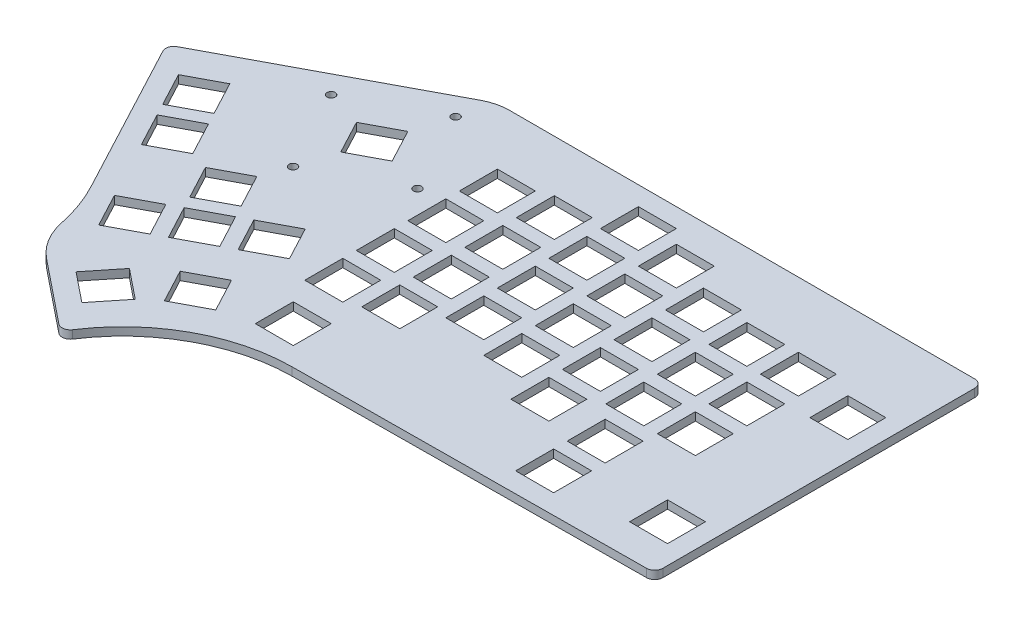
from build123d import *

# Parameters (mm, degrees)
SKETCH3_R   = 1.5
SKETCH3_W   = 14
SKETCH3_H   = 14
LASER_DEPTH = 3


with BuildPart() as part:
    # Sketch3 → Laser (new body)
    with BuildSketch(Plane(origin=(0, 0, 0), x_dir=(1, 0, 0), z_dir=(0, 1, 0))):
        with BuildLine():
            Line((-14.486734177, 37), (157, 37))
            ThreePointArc((157, 37), (159.121320344, 36.121320344), (160, 34))
            Line((160, 34), (160, -80.984375239))
            ThreePointArc((160, -80.984375239), (159.129622744, -83.097360561), (157.023528688, -83.984282971))
            Line((157.023528688, -83.984282971), (27.26862569, -85.001968485))
            ThreePointArc((27.26862569, -85.001968485), (-2.456705292, -92.729196832), (-24.985922812, -113.603576292))
            ThreePointArc((-24.985922812, -113.603576292), (-27.026813158, -114.929395936), (-29.379241112, -114.305606027))
            Line((-29.379241112, -114.305606027), (-52.510135606, -95.72030429))
            ThreePointArc((-52.510135606, -95.72030429), (-58.054538693, -89.41838891), (-61.142600429, -81.61336375))
            ThreePointArc((-61.142600429, -81.61336375), (-63.620659677, -72.842256523), (-67.314962408, -64.51007632))
            Line((-67.314962408, -64.51007632), (-97.34041061, -7.990411949))
            ThreePointArc((-97.34041061, -7.990411949), (-97.559643654, -5.704801569), (-96.098494227, -3.933609797))
            Line((-96.098494227, -3.933609797), (-23.071235452, 34.86131583))
            ThreePointArc((-23.071235452, 34.86131583), (-18.910183965, 36.457280449), (-14.486734177, 37))
        make_face()
        with Locations(Location((-22.393572022, 24.996840478, 0), (0, 0, 270))):
            Circle(SKETCH3_R, mode=Mode.SUBTRACT)
        with Locations(Location((-6.470173498, -4.977237981, 0), (0, 0, 270))):
            Circle(SKETCH3_R, mode=Mode.SUBTRACT)
        with Locations(Location((-36.444251957, -20.900636504, 0), (0, 0, 270))):
            Circle(SKETCH3_R, mode=Mode.SUBTRACT)
        with Locations(Location((-52.367650481, 9.073441955, 0), (0, 0, 270))):
            Circle(SKETCH3_R, mode=Mode.SUBTRACT)
        with Locations((9, -10)):
            Rectangle(SKETCH3_W, SKETCH3_H, mode=Mode.SUBTRACT)
        with Locations((9, 9)):
            Rectangle(SKETCH3_W, SKETCH3_H, mode=Mode.SUBTRACT)
        with Locations((28, 11)):
            Rectangle(SKETCH3_W, SKETCH3_H, mode=Mode.SUBTRACT)
        with Locations((47, 23)):
            Rectangle(SKETCH3_W, SKETCH3_H, mode=Mode.SUBTRACT)
        with Locations((66, 18)):
            Rectangle(SKETCH3_W, SKETCH3_H, mode=Mode.SUBTRACT)
        with Locations((85, 9)):
            Rectangle(SKETCH3_W, SKETCH3_H, mode=Mode.SUBTRACT)
        with Locations((104, 6)):
            Rectangle(SKETCH3_W, SKETCH3_H, mode=Mode.SUBTRACT)
        with Locations((123, 6)):
            Rectangle(SKETCH3_W, SKETCH3_H, mode=Mode.SUBTRACT)
        with Locations((146, 1.25)):
            Rectangle(SKETCH3_W, SKETCH3_H, mode=Mode.SUBTRACT)
        with Locations((146, -65.25)):
            Rectangle(SKETCH3_W, SKETCH3_H, mode=Mode.SUBTRACT)
        with Locations((28, -8)):
            Rectangle(SKETCH3_W, SKETCH3_H, mode=Mode.SUBTRACT)
        with Locations((47, 4)):
            Rectangle(SKETCH3_W, SKETCH3_H, mode=Mode.SUBTRACT)
        with Locations((66, -1)):
            Rectangle(SKETCH3_W, SKETCH3_H, mode=Mode.SUBTRACT)
        with Locations((85, -10)):
            Rectangle(SKETCH3_W, SKETCH3_H, mode=Mode.SUBTRACT)
        with Locations((104, -13)):
            Rectangle(SKETCH3_W, SKETCH3_H, mode=Mode.SUBTRACT)
        with Locations((123, -13)):
            Rectangle(SKETCH3_W, SKETCH3_H, mode=Mode.SUBTRACT)
        with Locations((9, -29)):
            Rectangle(SKETCH3_W, SKETCH3_H, mode=Mode.SUBTRACT)
        with Locations((28, -27)):
            Rectangle(SKETCH3_W, SKETCH3_H, mode=Mode.SUBTRACT)
        with Locations((47, -15)):
            Rectangle(SKETCH3_W, SKETCH3_H, mode=Mode.SUBTRACT)
        with Locations((66, -20)):
            Rectangle(SKETCH3_W, SKETCH3_H, mode=Mode.SUBTRACT)
        with Locations((85, -29)):
            Rectangle(SKETCH3_W, SKETCH3_H, mode=Mode.SUBTRACT)
        with Locations((104, -32)):
            Rectangle(SKETCH3_W, SKETCH3_H, mode=Mode.SUBTRACT)
        with Locations((123, -32)):
            Rectangle(SKETCH3_W, SKETCH3_H, mode=Mode.SUBTRACT)
        with Locations((9, -48)):
            Rectangle(SKETCH3_W, SKETCH3_H, mode=Mode.SUBTRACT)
        with Locations((28, -46)):
            Rectangle(SKETCH3_W, SKETCH3_H, mode=Mode.SUBTRACT)
        with Locations((47, -34)):
            Rectangle(SKETCH3_W, SKETCH3_H, mode=Mode.SUBTRACT)
        with Locations((66, -39)):
            Rectangle(SKETCH3_W, SKETCH3_H, mode=Mode.SUBTRACT)
        with Locations((85, -48)):
            Rectangle(SKETCH3_W, SKETCH3_H, mode=Mode.SUBTRACT)
        Polygon((-86.936243665, -12.654456356), (-74.572567085, -6.086389562), (-68.004500291, -18.450066143), (-80.368176871, -25.018132937), align=None, mode=Mode.SUBTRACT)
        with Locations((13.75, -71)):
            Rectangle(SKETCH3_W, SKETCH3_H, mode=Mode.SUBTRACT)
        with Locations((108.75, -51)):
            Rectangle(SKETCH3_W, SKETCH3_H, mode=Mode.SUBTRACT)
        with Locations((108.75, -70)):
            Rectangle(SKETCH3_W, SKETCH3_H, mode=Mode.SUBTRACT)
        Polygon((-65.65876215, -22.865664922), (-78.022438731, -29.433731716), (-71.454371937, -41.797408296), (-59.090695356, -35.229341502), align=None, mode=Mode.SUBTRACT)
        Polygon((-52.329358437, -37.29920214), (-39.965681856, -30.731135346), (-33.397615062, -43.094811927), (-45.761291642, -49.662878721), align=None, mode=Mode.SUBTRACT)
        Polygon((-26.636278142, -45.164672565), (-14.272601562, -38.596605771), (-7.704534768, -50.960282351), (-20.068211348, -57.528349145), align=None, mode=Mode.SUBTRACT)
        Polygon((-31.051876921, -47.510410705), (-43.415553502, -54.078477499), (-36.847486708, -66.44215408), (-24.483810127, -59.874087286), align=None, mode=Mode.SUBTRACT)
        Polygon((-47.831152281, -56.42421564), (-60.194828861, -62.992282434), (-53.626762067, -75.355959015), (-41.263085486, -68.787892221), align=None, mode=Mode.SUBTRACT)
        Polygon((-34.094882695, -83.577777362), (-42.863777875, -94.491368765), (-31.950186473, -103.260263946), (-23.181291292, -92.346672543), align=None, mode=Mode.SUBTRACT)
        Polygon((-23.864729376, -75.115009761), (-11.501052796, -68.546942967), (-4.932986002, -80.910619548), (-17.296662582, -87.478686342), align=None, mode=Mode.SUBTRACT)
        Polygon((-38.884783677, 4.94590688), (-26.521107096, 11.513973674), (-19.953040302, -0.849702906), (-32.316716883, -7.4177697), align=None, mode=Mode.SUBTRACT)
    extrude(amount=-LASER_DEPTH)


solid = part.part
